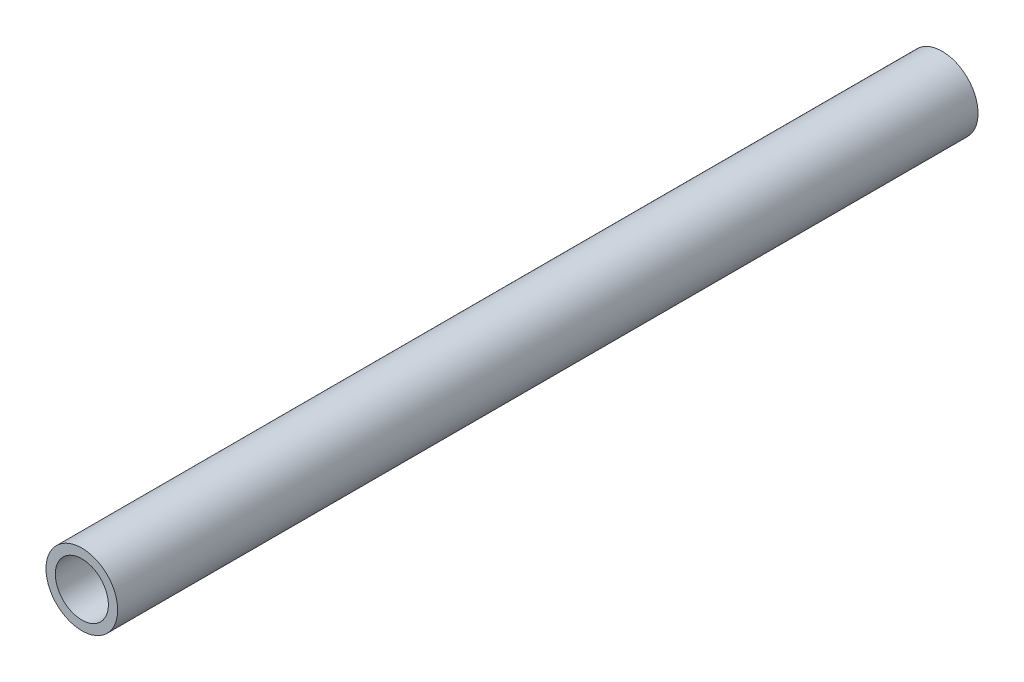
from build123d import *

# Parameters (mm, degrees)
SKETCH3_R           = 6.35
SKETCH3_R_2         = 4.699
BOSS_EXTRUDE1_DEPTH = 76.2


with BuildPart() as part:
    # Sketch3 → Boss-Extrude1 (new, symmetric)
    with BuildSketch(Plane.XY):
        with Locations(Location((0, 0, 0), (0, 0, 180))):
            Circle(SKETCH3_R)
        with Locations(Location((0, 0, 0), (0, 0, 180))):
            Circle(SKETCH3_R_2, mode=Mode.SUBTRACT)
    extrude(amount=BOSS_EXTRUDE1_DEPTH, both=True)


solid = part.part
